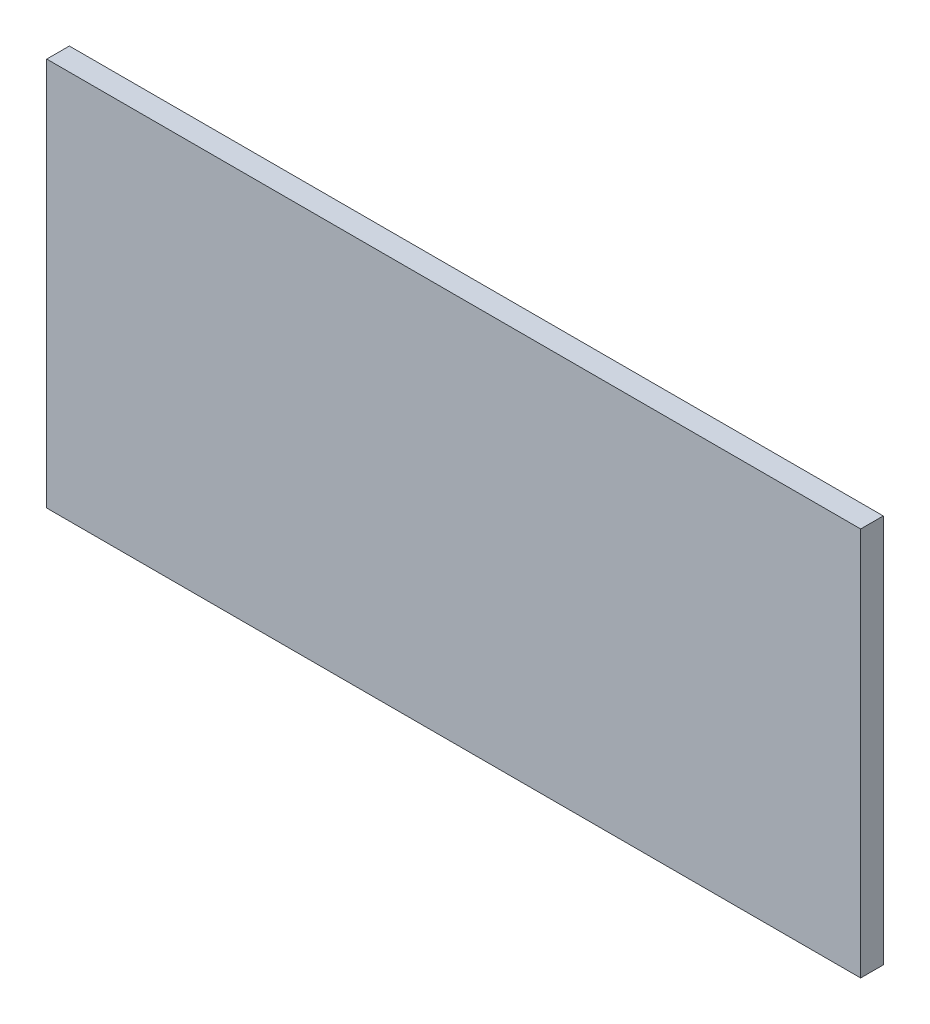
from build123d import *

# Parameters (mm, degrees)
SKETCH_1_W      = 90
SKETCH_1_H      = 43
EXTRUDE_1_DEPTH = 2.5


with BuildPart() as part:
    # 草圖1 → 填料-伸長1 (new body)
    with BuildSketch(Plane.XY):
        Rectangle(SKETCH_1_W, SKETCH_1_H)
    extrude(amount=EXTRUDE_1_DEPTH)


solid = part.part
